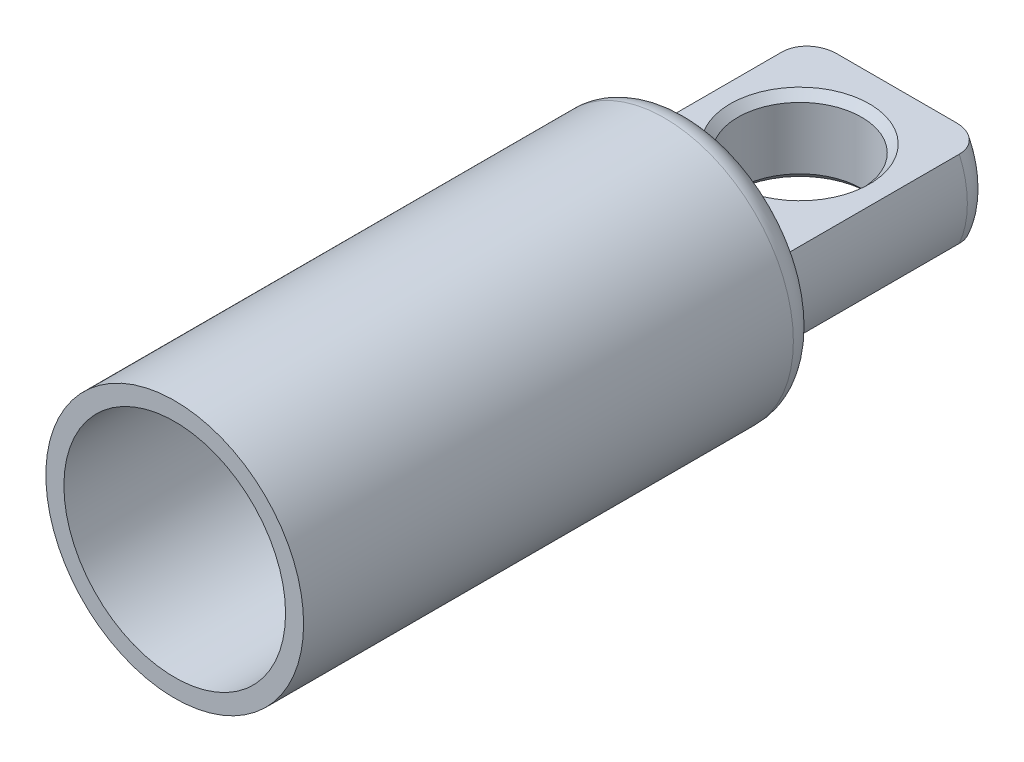
from build123d import *

# Parameters (mm, degrees)
SKETCH1_R               = 6.35
BOSS_EXTRUDE1_DEPTH     = 25.4
SHELL1_T                = -0.889
FILLET1_R               = 1.27
SKETCH2_R               = 4.7625
BOSS_EXTRUDE2_DEPTH     = 10.16
CUT_EXTRUDE1_START      = -10.16
CUT_EXTRUDE1_DEPTH      = 10.16
CUT_EXTRUDE2_DEPTH      = 28.452277258
CUT_EXTRUDE2_DEPTH_BACK = 28.452277258
SKETCH5_R               = 3.048
CHAMFER1_SIZE           = 0.381
FILLET2_R               = 1.27


with BuildPart() as part:
    # Sketch1 → Boss-Extrude1 (new body)
    with BuildSketch(Plane.XY):
        Circle(SKETCH1_R)
    extrude(amount=BOSS_EXTRUDE1_DEPTH)

    # Shell1
    shell1_openings = [part.faces().sort_by_distance(p)[0] for p in [
        (0, 0, 25.4),
    ]]
    offset(amount=SHELL1_T, openings=shell1_openings, kind=Kind.INTERSECTION)

    # Fillet1
    fillet1_edges = [part.edges().sort_by_distance(p)[0] for p in [
        (-6.35, 0, 0),
    ]]
    fillet(fillet1_edges, radius=FILLET1_R)

    # Sketch2 → Boss-Extrude2 (add)
    with BuildSketch(Plane(origin=(0, 0, 0), x_dir=(-1, 0, 0), z_dir=(0, 0, -1))):
        with Locations(Location((0, 0, 0), (0, 0, 180))):
            Circle(SKETCH2_R)
    extrude(amount=BOSS_EXTRUDE2_DEPTH)

    # Sketch3 → Cut-Extrude1 (cut)
    with BuildSketch(Plane(origin=(0, 0, -10.16), x_dir=(-1, 0, 0), z_dir=(0, 0, -1)).offset(CUT_EXTRUDE1_START)):
        with BuildLine():
            Line((4.364903349, 1.905), (-4.364903349, 1.905))
            ThreePointArc((-4.364903349, 1.905), (0, 4.7625), (4.364903349, 1.905))
        make_face()
        with BuildLine():
            Line((4.364903349, -1.905), (-4.364903349, -1.905))
            ThreePointArc((-4.364903349, -1.905), (0, -4.7625), (4.364903349, -1.905))
        make_face()
    extrude(amount=CUT_EXTRUDE1_DEPTH, mode=Mode.SUBTRACT)

    # Sketch5 → Cut-Extrude2 (cut, two sides: drawn at the far end of the back side and taken through both)
    with BuildSketch(Plane(origin=(0, 1.905, 0), x_dir=(1, 0, 0), z_dir=(0, 1, 0)).offset(-CUT_EXTRUDE2_DEPTH_BACK)):
        with Locations(Location((0, 5.3975, 0), (0, 0, 180))):
            Circle(SKETCH5_R)
    extrude(amount=CUT_EXTRUDE2_DEPTH + CUT_EXTRUDE2_DEPTH_BACK, mode=Mode.SUBTRACT)

    # Chamfer1
    chamfer1_edges = [part.edges().sort_by_distance(p)[0] for p in [
        (3.048, -1.905, -5.3975),
        (3.048, 1.905, -5.3975),
    ]]
    chamfer(chamfer1_edges, length=CHAMFER1_SIZE)

    # Fillet2
    fillet2_edges = [part.edges().sort_by_distance(p)[0] for p in [
        (4.7625, 0, -10.16),
        (-4.7625, 0, -10.16),
    ]]
    fillet(fillet2_edges, radius=FILLET2_R)


solid = part.part
